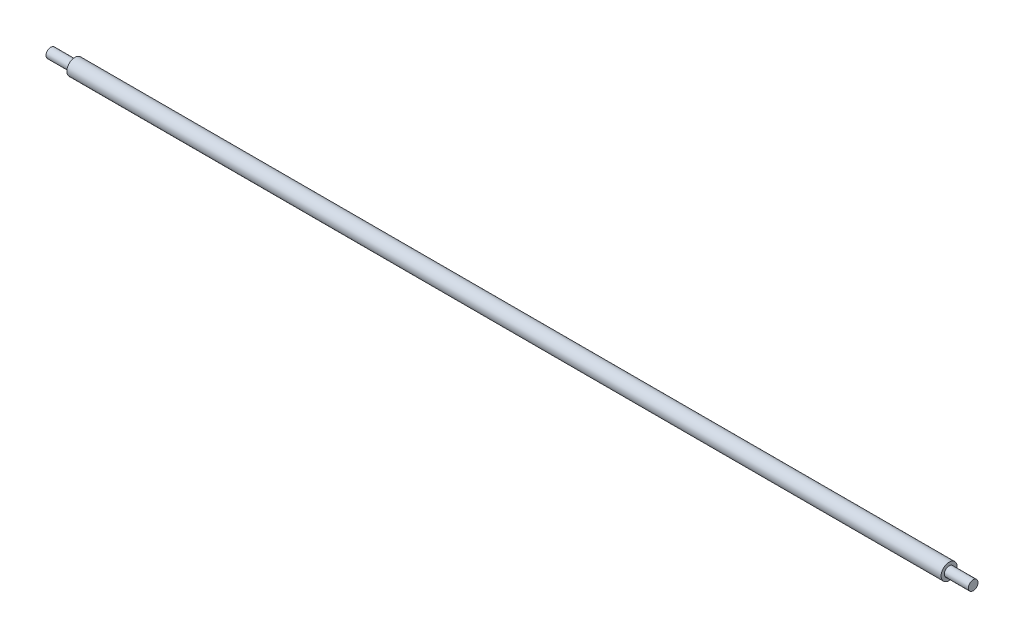
from build123d import *

# Parameters (mm, degrees)
EXTRUDE_1_DEPTH      = 275
EXTRUDE_1_DEPTH_BACK = 270
SKETCH_1_R           = 5
SKETCH_2_R           = 3
EXTRUDE_2_DEPTH      = 15
EXTRUDE_START        = 15
SKETCH_7_R           = 3
EXTRUDE_3_DEPTH      = 15


with BuildPart() as part:
    # Эскиз1 → Бобышка-Вытянуть1 (new, two sides: drawn at the far end of the back side and taken through both)
    with BuildSketch(Plane(origin=(0, 0, 0), x_dir=(0, 0, -1), z_dir=(1, 0, 0)).offset(-EXTRUDE_1_DEPTH_BACK)):
        Circle(SKETCH_1_R)
    extrude(amount=EXTRUDE_1_DEPTH + EXTRUDE_1_DEPTH_BACK)

    # Эскиз2 → Бобышка-Вытянуть2 (add)
    with BuildSketch(Plane.ZY.offset(270)):
        Circle(SKETCH_2_R)
    extrude(amount=EXTRUDE_2_DEPTH)

    # Эскиз7 → Бобышка-Вытянуть3 (add)
    with BuildSketch(Plane(origin=(275, 0, 0), x_dir=(0, 0, -1), z_dir=(1, 0, 0)).offset(EXTRUDE_START)):
        with Locations(Location((0, 0, 0), (0, 0, 180))):
            Circle(SKETCH_7_R)
    extrude(amount=-EXTRUDE_3_DEPTH)


solid = part.part
